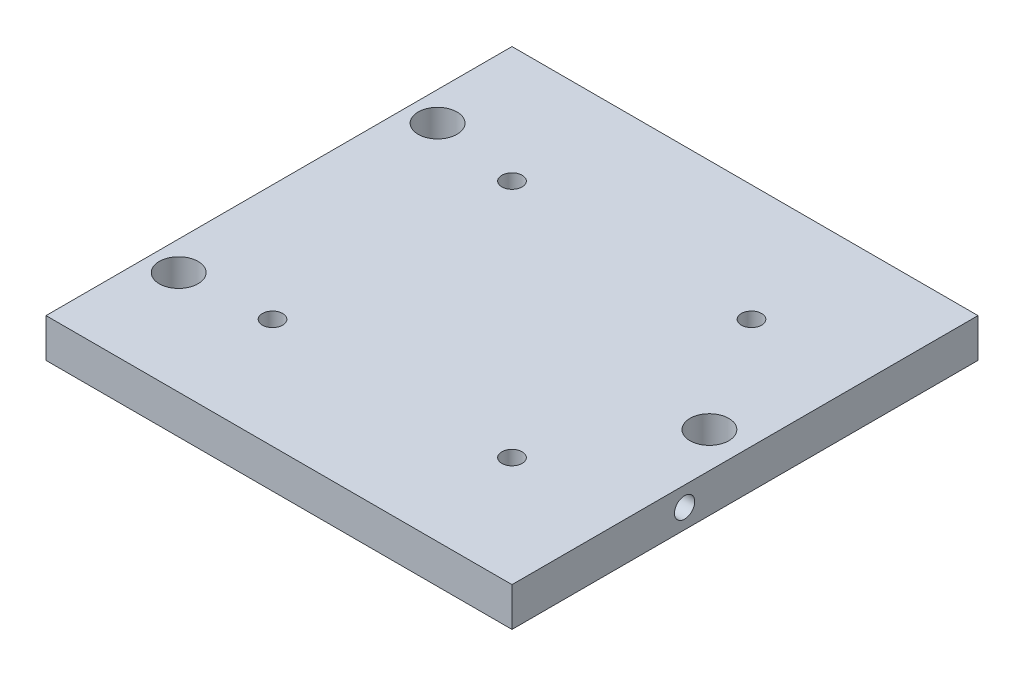
from build123d import *

# Parameters (mm, degrees)
SKETCH1_W                      = 114.3
SKETCH1_H                      = 114.3
SEEBECK_MIDDLE_BLOCK_DEPTH     = 9.525
SKETCH2_R                      = 0.79375
THERMO_COUPLE_HOLE_DEPTH       = 60.325
SKETCH3_R                      = 4.7625
MIDDLE_MOUNTING_HOLES_DEPTH    = 116.31336133
F_9_0_196_TEG_MOUNT_HOLE_D     = 4.9784
F_9_0_196_TEG_MOUNT_HOLE_DEPTH = 6.35
F_9_0_196_TEG_MOUNT_HOLE_TIP   = 1.495662253
F_9_0_196_VOLTAGE_HOLE_D       = 4.9784
F_9_0_196_VOLTAGE_HOLE_DEPTH   = 12.7
F_9_0_196_VOLTAGE_HOLE_TIP     = 1.495662253


with BuildPart() as part:
    # Sketch1 → Seebeck Middle Block (new body)
    with BuildSketch(Plane(origin=(0, 0, 0), x_dir=(1, 0, 0), z_dir=(0, 1, 0))):
        with Locations((24.209375, -24.0109375)):
            Rectangle(SKETCH1_W, SKETCH1_H)
    extrude(amount=SEEBECK_MIDDLE_BLOCK_DEPTH)

    # Sketch2 → Thermo Couple Hole (cut)
    with BuildSketch(Plane.ZY.offset(32.940625)):
        with Locations((24.0109375, 3.175)):
            Circle(SKETCH2_R)
    extrude(amount=-THERMO_COUPLE_HOLE_DEPTH, mode=Mode.SUBTRACT)

    # Sketch3 → Middle Mounting holes (cut, through all)
    with BuildSketch(Plane(origin=(0, 9.525, 0), x_dir=(1, 0, 0), z_dir=(0, 1, 0))):
        with Locations(Location((-25.796875, -55.7609375, 0), (0, 0, 270))):
            Circle(SKETCH3_R)
        with Locations(Location((-25.796875, 7.7390625, 0), (0, 0, 270))):
            Circle(SKETCH3_R)
        with Locations(Location((72.628125, -24.0109375, 0), (0, 0, 270))):
            Circle(SKETCH3_R)
    extrude(amount=-MIDDLE_MOUNTING_HOLES_DEPTH, mode=Mode.SUBTRACT)

    # #9 (0.196) TEG Mount Hole
    with Locations(Plane(origin=(0, 9.525, 0), x_dir=(1, 0, 0), z_dir=(0, 1, 0))):
        with Locations((-4.365625, 4.5640625), (54.371875, 4.5640625), (54.371875, -54.1734375), (-4.365625, -54.1734375)):
            Hole(F_9_0_196_TEG_MOUNT_HOLE_D / 2, depth=F_9_0_196_TEG_MOUNT_HOLE_DEPTH)
            with Locations((0, 0, -(F_9_0_196_TEG_MOUNT_HOLE_DEPTH + F_9_0_196_TEG_MOUNT_HOLE_TIP / 2))):  # 118° drill point
                Cone(0, F_9_0_196_TEG_MOUNT_HOLE_D / 2, F_9_0_196_TEG_MOUNT_HOLE_TIP, mode=Mode.SUBTRACT)

    # #9 (0.196) Voltage Hole
    with Locations(Plane(origin=(81.359375, 0, 0), x_dir=(0, 0, -1), z_dir=(1, 0, 0))):
        with Locations((-38.827604082, 4.7625)):
            Hole(F_9_0_196_VOLTAGE_HOLE_D / 2, depth=F_9_0_196_VOLTAGE_HOLE_DEPTH)
            with Locations((0, 0, -(F_9_0_196_VOLTAGE_HOLE_DEPTH + F_9_0_196_VOLTAGE_HOLE_TIP / 2))):  # 118° drill point
                Cone(0, F_9_0_196_VOLTAGE_HOLE_D / 2, F_9_0_196_VOLTAGE_HOLE_TIP, mode=Mode.SUBTRACT)


solid = part.part
